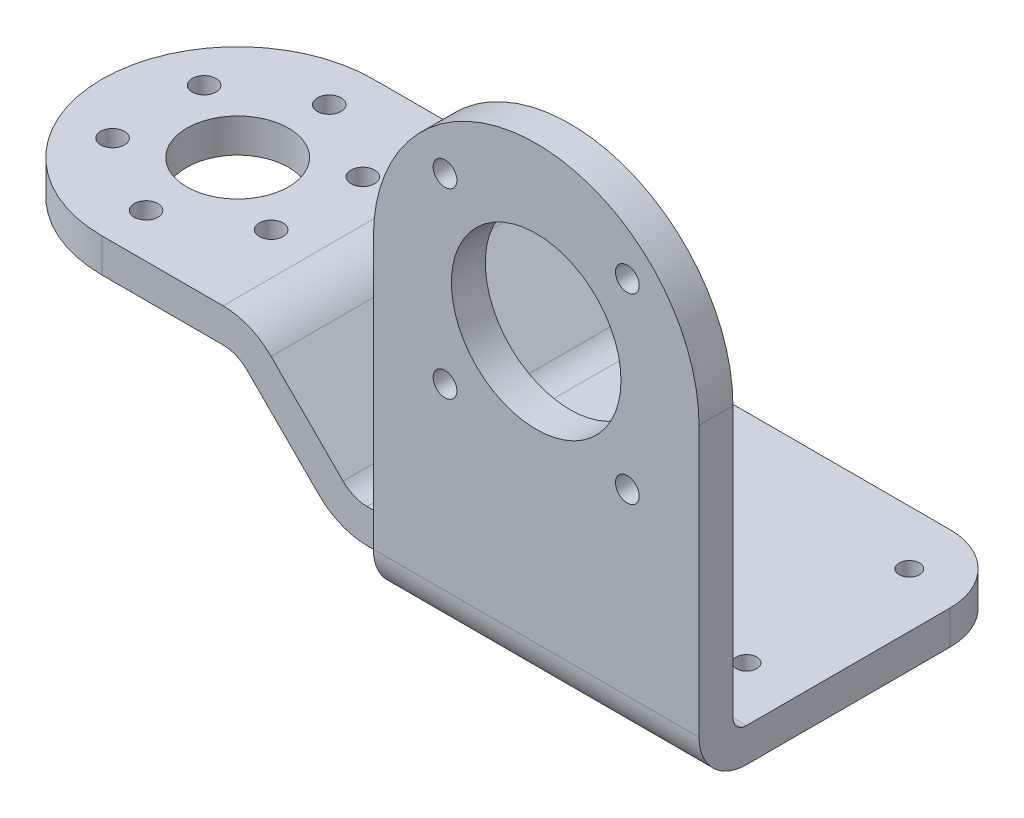
from build123d import *

# Parameters (mm, degrees)
SKETCH_1_R           = 20
SKETCH_1_W           = 48
SKETCH_1_H           = 7
EXTRUDE_1_DEPTH      = 5
SKETCH_3_R           = 1.75
CUT_EXTRUDE_1_DEPTH  = 11
EXTRUDE_3_DEPTH      = 5
FILLET_8_R           = 2
FILLET_9_R           = 7
FILLET_10_R          = 10
SKETCH_9_R           = 1.75
CUT_EXTRUDE_2_DEPTH  = 5
EXTRUDE_START        = 15
SKETCH_10_R          = 1.75
EXTRUDE_4_DEPTH      = 15
CUT_EXTRUDE_4_DEPTH  = 40
FILLET_11_R          = 5
FILLET_12_R          = 10
FILLET_13_R          = 10
FILLET_14_R          = 5
SKETCH_17_R          = 7.5
CUT_EXTRUDE_9_DEPTH  = 10
SKETCH_18_R          = 12.5
CUT_EXTRUDE_10_DEPTH = 10
SKETCH_21_R          = 1.5
CUT_EXTRUDE_13_DEPTH = 10


with BuildPart() as part:
    # 草图1 → 凸台-拉伸1 (new body)
    with BuildSketch(Plane(origin=(0, 0, 0), x_dir=(1, 0, 0), z_dir=(0, 1, 0))):
        Circle(SKETCH_1_R)
        with BuildLine():
            Line((95, 20), (0, 20))
            ThreePointArc((0, 20), (14.142135624, 14.142135624), (20, 0))
            ThreePointArc((20, 0), (14.142135624, -14.142135624), (0, -20))
            Line((0, -20), (47, -20))
            Line((47, -20), (95, -20))
            Line((95, -20), (95, 20))
        make_face()
        with Locations((71, -23.5)):
            Rectangle(SKETCH_1_W, SKETCH_1_H)
    extrude(amount=EXTRUDE_1_DEPTH)

    # 草图3 → 切除-拉伸1 (cut)
    with BuildSketch(Plane(origin=(0, 5, 0), x_dir=(1, 0, 0), z_dir=(0, 1, 0))):
        with Locations(Location((0, 13.5, 0), (0, 0, 270))):
            Circle(SKETCH_3_R)
        with Locations(Location((11.691342951, 6.75, 0), (0, 0, 270))):
            Circle(SKETCH_3_R)
        with Locations(Location((11.691342951, -6.75, 0), (0, 0, 270))):
            Circle(SKETCH_3_R)
        with Locations(Location((0, -13.5, 0), (0, 0, 270))):
            Circle(SKETCH_3_R)
        with Locations(Location((-11.691342951, -6.75, 0), (0, 0, 270))):
            Circle(SKETCH_3_R)
        with Locations(Location((-11.691342951, 6.75, 0), (0, 0, 270))):
            Circle(SKETCH_3_R)
    extrude(amount=-CUT_EXTRUDE_1_DEPTH, mode=Mode.SUBTRACT)

    # 草图8 → 凸台-拉伸3 (add)
    with BuildSketch(Plane.XY.offset(27)):
        with BuildLine():
            Line((95, 46.8), (95, 0))
            Line((95, 0), (47, 0))
            Line((47, 0), (47, 46.8))
            ThreePointArc((47, 46.8), (71, 70.8), (95, 46.8))
        make_face()
    extrude(amount=-EXTRUDE_3_DEPTH)

    # 圆角8
    fillet_8_edges = [part.edges().sort_by_distance(p)[0] for p in [
        (71, 5, 22),
    ]]
    fillet(fillet_8_edges, radius=FILLET_8_R)

    # 圆角9
    fillet_9_edges = [part.edges().sort_by_distance(p)[0] for p in [
        (71, 0, 27),
    ]]
    fillet(fillet_9_edges, radius=FILLET_9_R)

    # 圆角10
    fillet_10_edges = [part.edges().sort_by_distance(p)[0] for p in [
        (95, 2.5, -20),
    ]]
    fillet(fillet_10_edges, radius=FILLET_10_R)

    # 草图9 → 切除-拉伸2 (cut)
    with BuildSketch(Plane.XY.offset(27)):
        with Locations((57.564971157, 60.235028843)):
            Circle(SKETCH_9_R)
        with Locations((84.435028843, 60.235028843)):
            Circle(SKETCH_9_R)
        with Locations((84.435028843, 33.364971157)):
            Circle(SKETCH_9_R)
        with Locations((57.564971157, 33.364971157)):
            Circle(SKETCH_9_R)
    extrude(amount=-CUT_EXTRUDE_2_DEPTH, mode=Mode.SUBTRACT)

    # 草图10 → 凸台-拉伸4 (add)
    with BuildSketch(Plane(origin=(0, 5, 0), x_dir=(1, 0, 0), z_dir=(0, 1, 0)).offset(EXTRUDE_START)):
        with BuildLine():
            Line((50, 20), (0, 20))
            ThreePointArc((0, 20), (-20, -7e-09), (1.4e-08, -20))
            Line((1.4e-08, -20), (50, -20))
            Line((50, -20), (50, 20))
        make_face()
        with Locations(Location((11.691342951, 6.75, 0), (0, 0, 270))):
            Circle(SKETCH_10_R, mode=Mode.SUBTRACT)
        with Locations(Location((0, 13.5, 0), (0, 0, 270))):
            Circle(SKETCH_10_R, mode=Mode.SUBTRACT)
        with Locations(Location((0, -13.5, 0), (0, 0, 270))):
            Circle(SKETCH_10_R, mode=Mode.SUBTRACT)
        with Locations(Location((-11.691342951, -6.75, 0), (0, 0, 270))):
            Circle(SKETCH_10_R, mode=Mode.SUBTRACT)
        with Locations(Location((11.691342951, -6.75, 0), (0, 0, 270))):
            Circle(SKETCH_10_R, mode=Mode.SUBTRACT)
        with Locations(Location((-11.691342951, 6.75, 0), (0, 0, 270))):
            Circle(SKETCH_10_R, mode=Mode.SUBTRACT)
    extrude(amount=-EXTRUDE_4_DEPTH)

    # 草图11 → 切除-拉伸4 (cut)
    with BuildSketch(Plane(origin=(0, 0, -20), x_dir=(-1, 0, 0), z_dir=(0, 0, -1))):
        Polygon((-50, 5), (-37, 5), (-22, 20), (-50, 20), align=None)
        Polygon((20, 0), (20, 15), (-19.928932188, 15), (-34.928932188, 0), align=None)
    extrude(amount=-CUT_EXTRUDE_4_DEPTH, mode=Mode.SUBTRACT)

    # 圆角11
    fillet_11_edges = [part.edges().sort_by_distance(p)[0] for p in [
        (19.928932188, 15, 0),
    ]]
    fillet(fillet_11_edges, radius=FILLET_11_R)

    # 圆角12
    fillet_12_edges = [part.edges().sort_by_distance(p)[0] for p in [
        (22, 20, 0),
    ]]
    fillet(fillet_12_edges, radius=FILLET_12_R)

    # 圆角13
    fillet_13_edges = [part.edges().sort_by_distance(p)[0] for p in [
        (34.928932188, 0, 0),
    ]]
    fillet(fillet_13_edges, radius=FILLET_13_R)

    # 圆角14
    fillet_14_edges = [part.edges().sort_by_distance(p)[0] for p in [
        (37, 5, 0),
    ]]
    fillet(fillet_14_edges, radius=FILLET_14_R)

    # 草图17 → 切除-拉伸9 (cut)
    with BuildSketch(Plane(origin=(0, 20, 0), x_dir=(1, 0, 0), z_dir=(0, 1, 0))):
        with Locations(Location((0, 0, 0), (0, 0, 270))):
            Circle(SKETCH_17_R)
    extrude(amount=-CUT_EXTRUDE_9_DEPTH, mode=Mode.SUBTRACT)

    # 草图18 → 切除-拉伸10 (cut)
    with BuildSketch(Plane.XY.offset(27)):
        with Locations((71, 46.8)):
            Circle(SKETCH_18_R)
    extrude(amount=-CUT_EXTRUDE_10_DEPTH, mode=Mode.SUBTRACT)

    # 草图21 → 切除-拉伸13 (cut)
    with BuildSketch(Plane.XZ):
        with Locations(Location((87, 12, 0), (0, 0, 270))):
            Circle(SKETCH_21_R)
        with Locations(Location((47.071067812, -12, 0), (0, 0, 270))):
            Circle(SKETCH_21_R)
        with Locations(Location((47.071067812, 12, 0), (0, 0, 270))):
            Circle(SKETCH_21_R)
        with Locations(Location((87, -12, 0), (0, 0, 270))):
            Circle(SKETCH_21_R)
    extrude(amount=-CUT_EXTRUDE_13_DEPTH, mode=Mode.SUBTRACT)


solid = part.part
